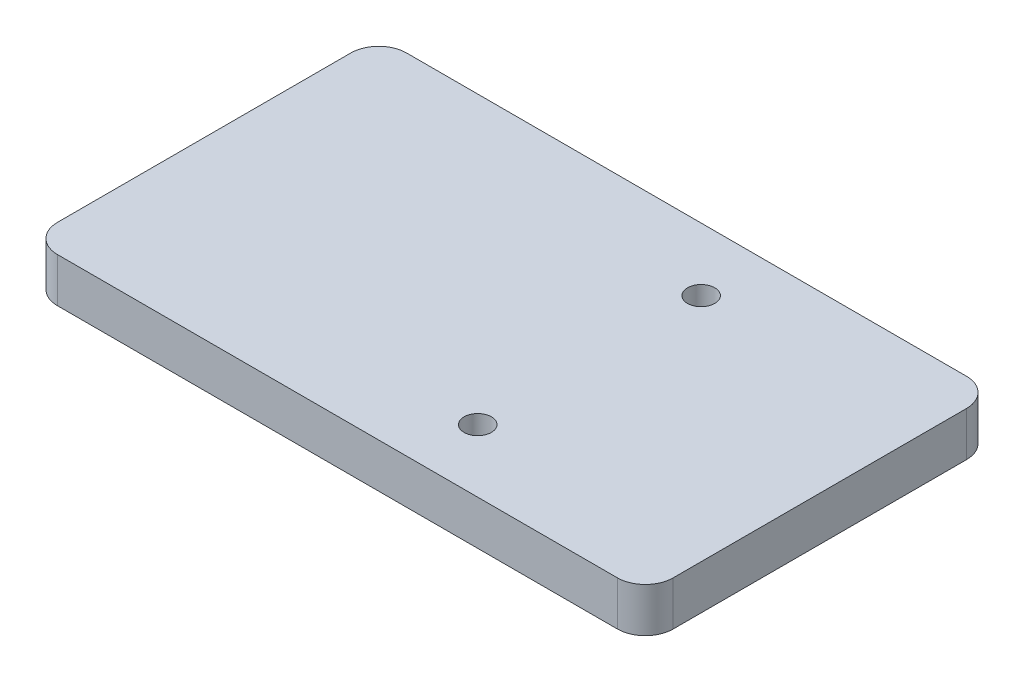
from build123d import *

# Parameters (mm, degrees)
SKETCH1_W           = 88.18
SKETCH1_H           = 50
SKETCH1_R           = 1.95
BOSS_EXTRUDE1_DEPTH = 6.35
FILLET1_R           = 4


with BuildPart() as part:
    # Sketch1 → Boss-Extrude1 (new body)
    with BuildSketch(Plane(origin=(0, 0, 0), x_dir=(1, 0, 0), z_dir=(0, 1, 0))):
        Rectangle(SKETCH1_W, SKETCH1_H)
        with Locations(Location((11.09, 16, 0), (0, 0, 270))):
            Circle(SKETCH1_R, mode=Mode.SUBTRACT)
        with Locations(Location((11.09, -16, 0), (0, 0, 270))):
            Circle(SKETCH1_R, mode=Mode.SUBTRACT)
    extrude(amount=BOSS_EXTRUDE1_DEPTH)

    # Fillet1
    fillet1_edges = [part.edges().sort_by_distance(p)[0] for p in [
        (44.09, 3.175, 25),
        (-44.09, 3.175, 25),
        (-44.09, 3.175, -25),
        (44.09, 3.175, -25),
    ]]
    fillet(fillet1_edges, radius=FILLET1_R)


solid = part.part
